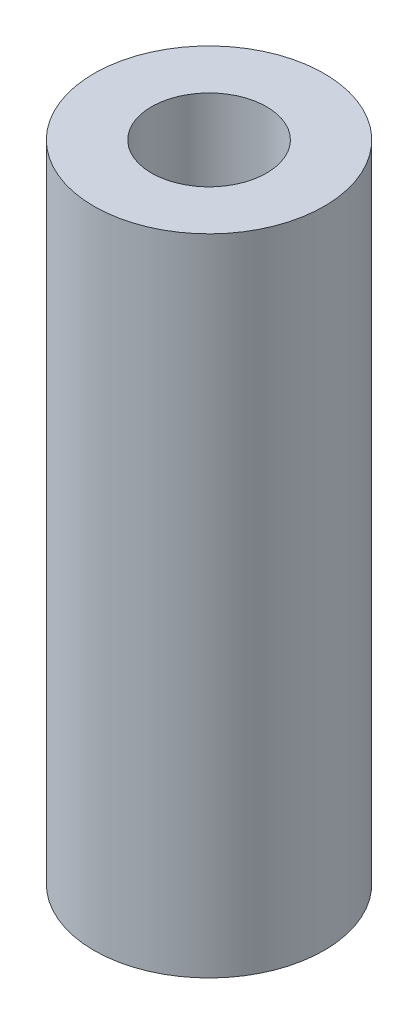
from build123d import *

# Parameters (mm, degrees)
SKETCH1_R           = 2.5
SKETCH1_R_2         = 1.25
BOSS_EXTRUDE1_DEPTH = 14


with BuildPart() as part:
    # Sketch1 → Boss-Extrude1 (new body)
    with BuildSketch(Plane(origin=(0, 0, 0), x_dir=(1, 0, 0), z_dir=(0, 1, 0))):
        with Locations(Location((0, 0, 0), (0, 0, 270))):
            Circle(SKETCH1_R)
        with Locations(Location((0, 0, 0), (0, 0, 270))):
            Circle(SKETCH1_R_2, mode=Mode.SUBTRACT)
    extrude(amount=BOSS_EXTRUDE1_DEPTH)


solid = part.part
